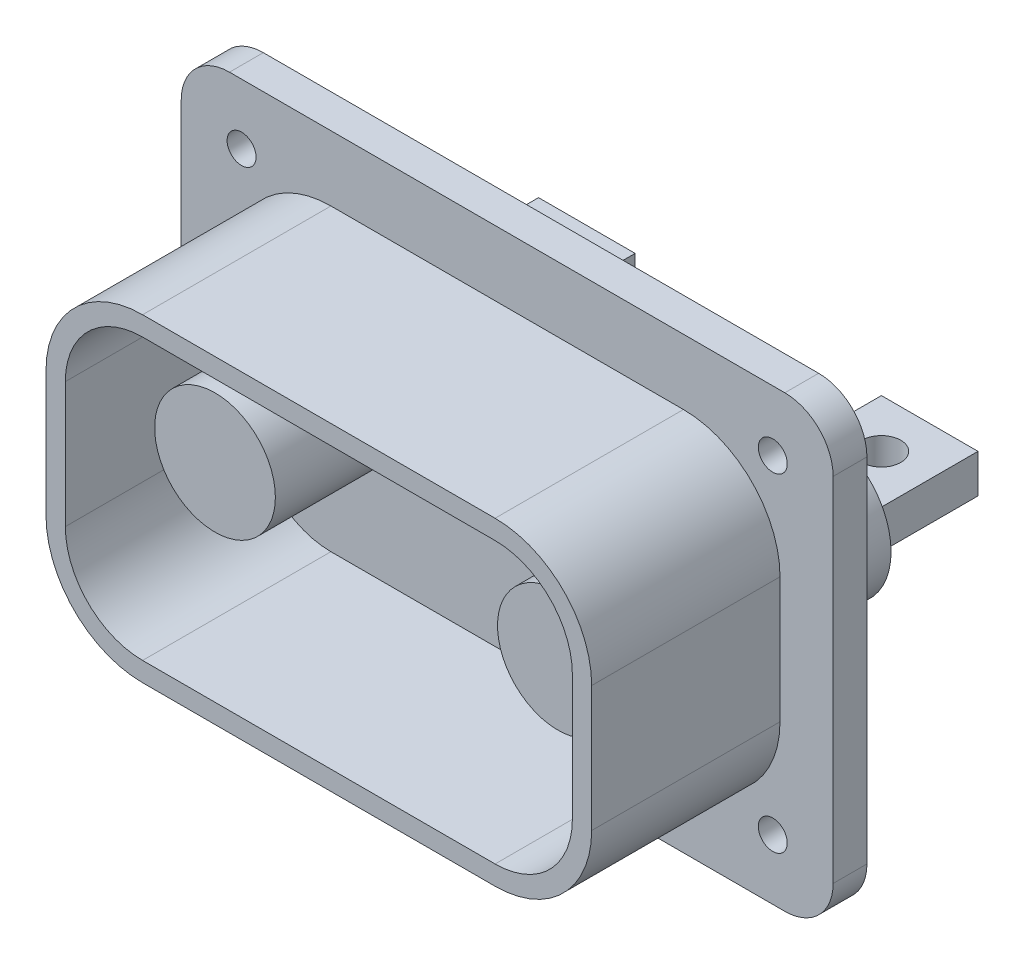
from build123d import *

# Parameters (mm, degrees)
SKETCH1_W           = 135
SKETCH1_H           = 93
SKETCH1_R           = 3
BOSS_EXTRUDE1_DEPTH = 7
BOSS_EXTRUDE2_DEPTH = 39
FILLET1_R           = 10
SKETCH3_R           = 15
BOSS_EXTRUDE3_DEPTH = 22
SKETCH5_W           = 20
SKETCH5_H           = 8
BOSS_EXTRUDE4_DEPTH = 23
SKETCH6_R           = 4
CUT_EXTRUDE1_DEPTH  = 97.033848199
SKETCH7_R           = 12.5
BOSS_EXTRUDE5_DEPTH = 25


with BuildPart() as part:
    # Sketch1 → Boss-Extrude1 (new body)
    with BuildSketch(Plane.XY):
        Rectangle(SKETCH1_W, SKETCH1_H)
        with Locations((-55, 34)):
            Circle(SKETCH1_R, mode=Mode.SUBTRACT)
        with Locations((55, 34)):
            Circle(SKETCH1_R, mode=Mode.SUBTRACT)
        with Locations((55, -34)):
            Circle(SKETCH1_R, mode=Mode.SUBTRACT)
        with Locations((-55, -34)):
            Circle(SKETCH1_R, mode=Mode.SUBTRACT)
    extrude(amount=BOSS_EXTRUDE1_DEPTH)

    # Sketch2 → Boss-Extrude2 (add)
    with BuildSketch(Plane.XY.offset(7)):
        with BuildLine():
            Line((-36.5, 33), (36.5, 33))
            ThreePointArc((36.5, 33), (50.642135624, 27.142135624), (56.5, 13))
            Line((56.5, 13), (56.5, -13))
            ThreePointArc((56.5, -13), (50.642135624, -27.142135624), (36.5, -33))
            Line((36.5, -33), (-36.5, -33))
            ThreePointArc((-36.5, -33), (-50.642135624, -27.142135624), (-56.5, -13))
            Line((-56.5, -13), (-56.5, 13))
            ThreePointArc((-56.5, 13), (-50.642135624, 27.142135624), (-36.5, 33))
        make_face()
        with BuildLine():
            Line((-52.5, 13), (-52.5, -13))
            ThreePointArc((-52.5, -13), (-47.813708499, -24.313708499), (-36.5, -29))
            Line((-36.5, -29), (36.5, -29))
            ThreePointArc((36.5, -29), (47.813708499, -24.313708499), (52.5, -13))
            Line((52.5, -13), (52.5, 13))
            ThreePointArc((52.5, 13), (47.813708499, 24.313708499), (36.5, 29))
            Line((36.5, 29), (-36.5, 29))
            ThreePointArc((-36.5, 29), (-47.813708499, 24.313708499), (-52.5, 13))
        make_face(mode=Mode.SUBTRACT)
    extrude(amount=BOSS_EXTRUDE2_DEPTH)

    # Fillet1
    fillet1_edges = [part.edges().sort_by_distance(p)[0] for p in [
        (-67.5, -46.5, 3.5),
        (-67.5, 46.5, 3.5),
        (67.5, 46.5, 3.5),
        (67.5, -46.5, 3.5),
    ]]
    fillet(fillet1_edges, radius=FILLET1_R)

    # Sketch3 → Boss-Extrude3 (add)
    with BuildSketch(Plane(origin=(0, 0, 0), x_dir=(-1, 0, 0), z_dir=(0, 0, -1))):
        with Locations(Location((-35.5, 0, 0), (0, 0, 180))):
            Circle(SKETCH3_R)
        with Locations(Location((35.5, 0, 0), (0, 0, 180))):
            Circle(SKETCH3_R)
    extrude(amount=BOSS_EXTRUDE3_DEPTH)

    # Sketch5 → Boss-Extrude4 (add)
    with BuildSketch(Plane(origin=(0, 0, -22), x_dir=(-1, 0, 0), z_dir=(0, 0, -1))):
        with Locations((-35.5, 0)):
            Rectangle(SKETCH5_W, SKETCH5_H)
        with Locations((35.5, 0)):
            Rectangle(SKETCH5_W, SKETCH5_H)
    extrude(amount=BOSS_EXTRUDE4_DEPTH)

    # Sketch6 → Cut-Extrude1 (cut, through all)
    with BuildSketch(Plane(origin=(0, 4, 0), x_dir=(1, 0, 0), z_dir=(0, 1, 0))):
        with Locations(Location((35.5, 35, 0), (0, 0, 270))):
            Circle(SKETCH6_R)
        with Locations(Location((-35.5, 35, 0), (0, 0, 270))):
            Circle(SKETCH6_R)
    extrude(amount=-CUT_EXTRUDE1_DEPTH, mode=Mode.SUBTRACT)

    # Sketch7 → Boss-Extrude5 (add)
    with BuildSketch(Plane.XY.offset(7)):
        with Locations((-35.5, 0)):
            Circle(SKETCH7_R)
        with Locations((35.5, 0)):
            Circle(SKETCH7_R)
    extrude(amount=BOSS_EXTRUDE5_DEPTH)


solid = part.part
